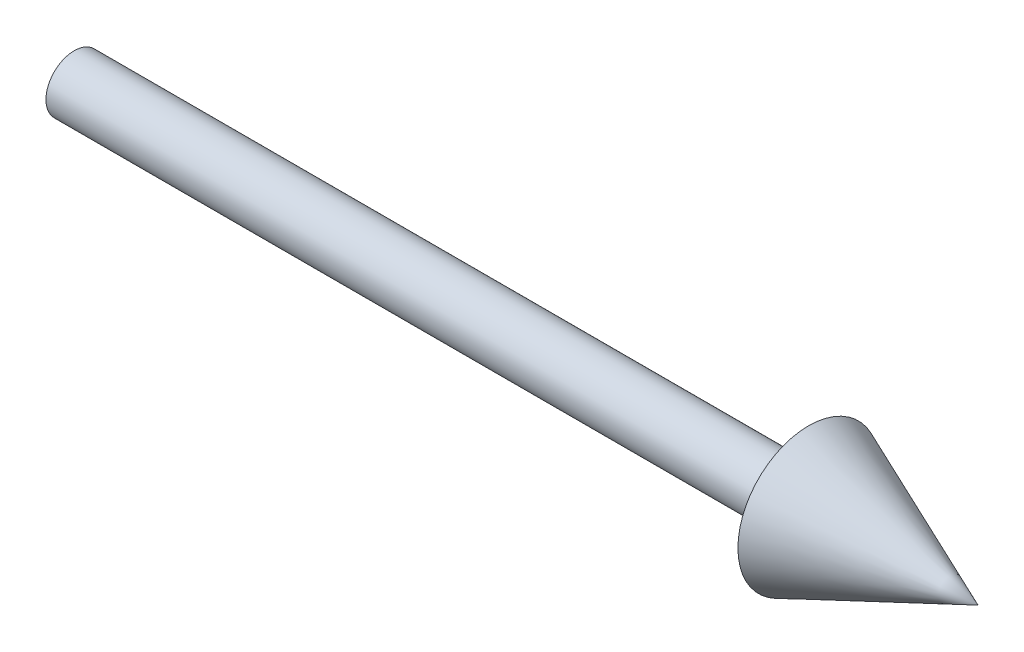
from build123d import *


with BuildPart() as part:
    # Sketch1 → Revolve1 (revolve)
    with BuildSketch(Plane.XY, mode=Mode.PRIVATE) as revolve1_sk:
        Polygon((0, 0), (0, 5), (130, 5), (130, 12.5), (160, 0), align=None)
    revolve(revolve1_sk.sketch.rotate(Axis((0, 0, 0), (-1, 0, 0)), 90), axis=Axis((0, 0, 0), (-1, 0, 0)))


solid = part.part
